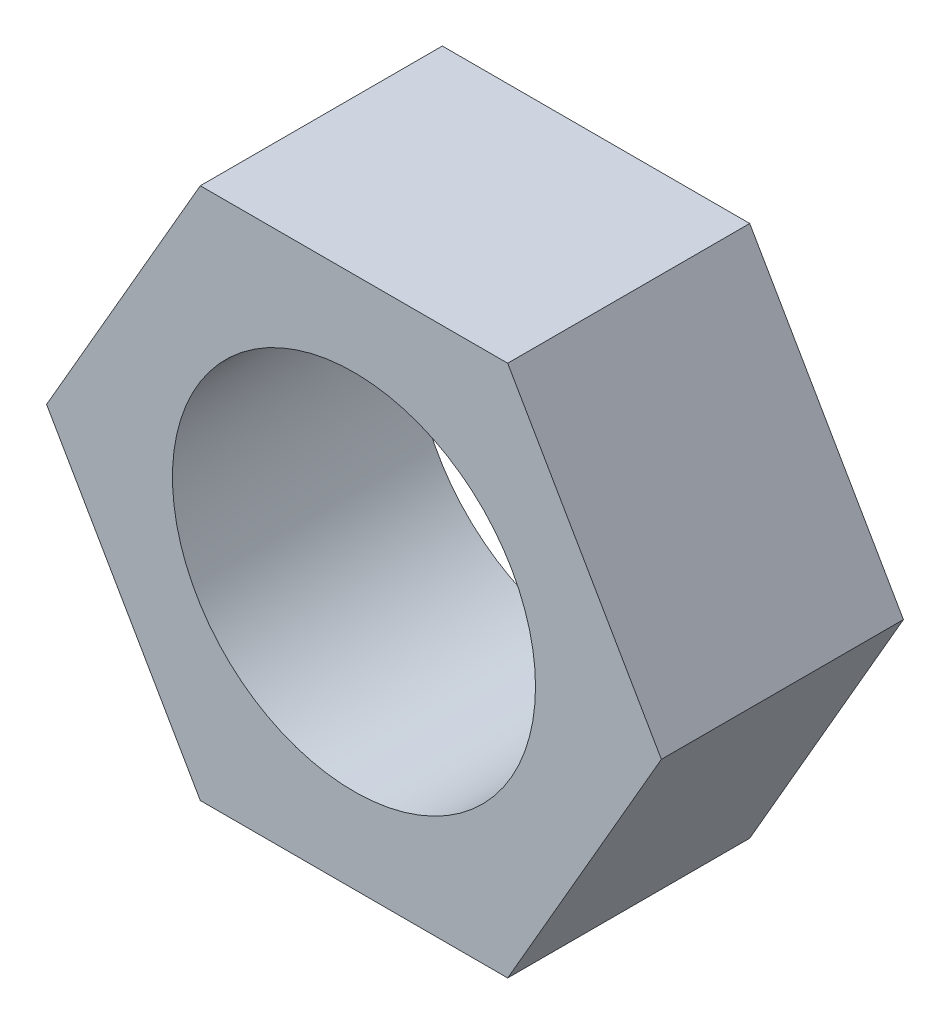
from build123d import *

# Parameters (mm, degrees)
SKETCH1_R           = 1.5
BOSS_EXTRUDE1_DEPTH = 2


with BuildPart() as part:
    # Sketch1 → Boss-Extrude1 (new body)
    with BuildSketch(Plane.XY):
        Polygon((1.27, 2.199704526), (-1.27, 2.199704526), (-2.54, 0), (-1.27, -2.199704526), (1.27, -2.199704526), (2.54, 0), align=None)
        Circle(SKETCH1_R, mode=Mode.SUBTRACT)
    extrude(amount=BOSS_EXTRUDE1_DEPTH)


solid = part.part
